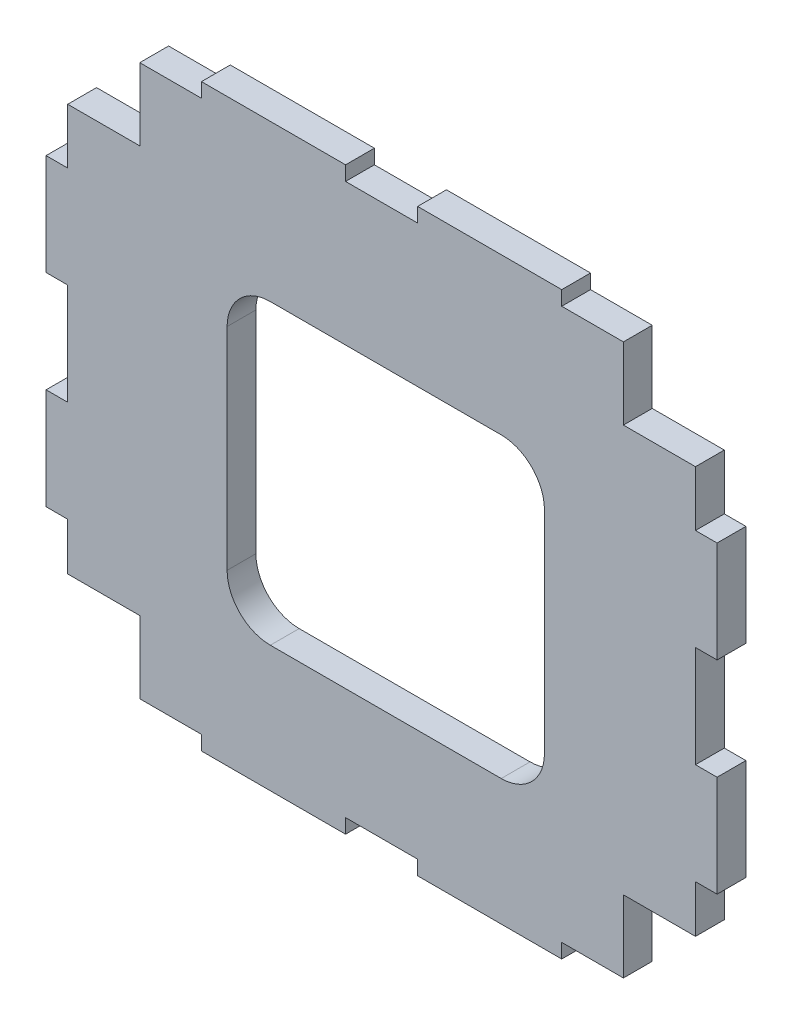
from build123d import *

# Parameters (mm, degrees)
EXTRUDE_1_DEPTH = 2


with BuildPart() as part:
    # Model → 凸台-拉伸1 (new body)
    with BuildSketch(Plane.XY):
        Polygon((32.051146309, 46.666411473), (27.771146309, 46.666411473), (27.771146309, 41.666411473), (22.771146309, 41.666411473), (22.771146309, 37.830678098), (21.271146309, 37.830678098), (21.271146309, 30.830678098), (21.271146309, 30.801723709), (22.771146309, 30.801723709), (22.771146309, 23.756343709), (21.271146309, 23.756343709), (21.271146309, 23.72738932), (21.271146309, 16.72738932), (22.771146309, 16.72738932), (22.771146309, 13.439545087), (27.771146309, 13.439545087), (27.771146309, 8.439545087), (32.051146309, 8.439545087), (32.051146309, 7.439189381), (42.051146309, 7.439189381), (42.051146309, 8.439545087), (47.051146309, 8.439545087), (47.051146309, 7.439189381), (57.051146309, 7.439189381), (57.051146309, 8.439545087), (61.331146309, 8.439545087), (61.331146309, 13.439545087), (66.331146309, 13.439545087), (66.331146309, 16.72738932), (67.831146309, 16.72738932), (67.831146309, 23.72738932), (67.831146309, 23.756343709), (66.331146309, 23.756343709), (66.331146309, 30.801723709), (67.831146309, 30.801723709), (67.831146309, 30.830678098), (67.831146309, 37.830678098), (66.331146309, 37.830678098), (66.331146309, 41.666411473), (61.331146309, 41.666411473), (61.331146309, 46.666411473), (57.051146309, 46.666411473), (57.051146309, 47.666767179), (47.051146309, 47.666767179), (47.051146309, 46.666411473), (42.051146309, 46.666411473), (42.051146309, 47.666767179), (32.051146309, 47.666767179), align=None)
        with BuildLine():
            Line((36.831877426, 36.838064871), (52.851877426, 36.838064871))
            ThreePointArc((52.851877426, 36.838064871), (54.97319777, 35.959385214), (55.851877426, 33.838064871))
            Line((55.851877426, 33.838064871), (55.851877426, 19.188064871))
            ThreePointArc((55.851877426, 19.188064871), (54.97319777, 17.066744527), (52.851877426, 16.188064871))
            Line((52.851877426, 16.188064871), (36.831877426, 16.188064871))
            ThreePointArc((36.831877426, 16.188064871), (34.710557082, 17.066744527), (33.831877426, 19.188064871))
            Line((33.831877426, 19.188064871), (33.831877426, 33.838064871))
            ThreePointArc((33.831877426, 33.838064871), (34.710557082, 35.959385214), (36.831877426, 36.838064871))
        make_face(mode=Mode.SUBTRACT)
    extrude(amount=EXTRUDE_1_DEPTH)


solid = part.part
